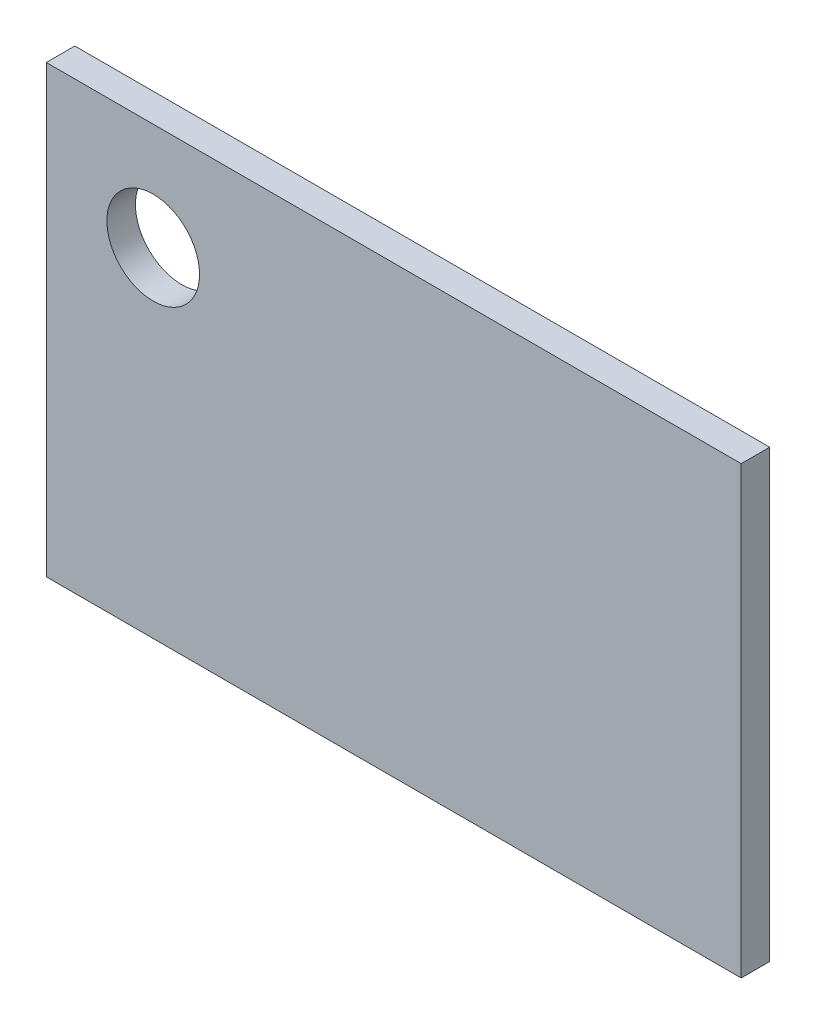
from build123d import *

# Parameters (mm, degrees)
ESQUISSE1_W             = 19.5
ESQUISSE1_H             = 12.5
BOSS_EXTRU_1_DEPTH      = 0.8
ESQUISSE2_R             = 1.3
ENL_V_MAT_EXTRU_1_DEPTH = 0.8


with BuildPart() as part:
    # Esquisse1 → Boss.-Extru.1 (new body)
    with BuildSketch(Plane.XY):
        Rectangle(ESQUISSE1_W, ESQUISSE1_H)
    extrude(amount=BOSS_EXTRU_1_DEPTH)

    # Esquisse2 → Enlèv. mat.-Extru.1 (cut)
    with BuildSketch(Plane.XY.offset(0.8)):
        with Locations((-6.75, 3.25)):
            Circle(ESQUISSE2_R)
    extrude(amount=-ENL_V_MAT_EXTRU_1_DEPTH, mode=Mode.SUBTRACT)


solid = part.part
